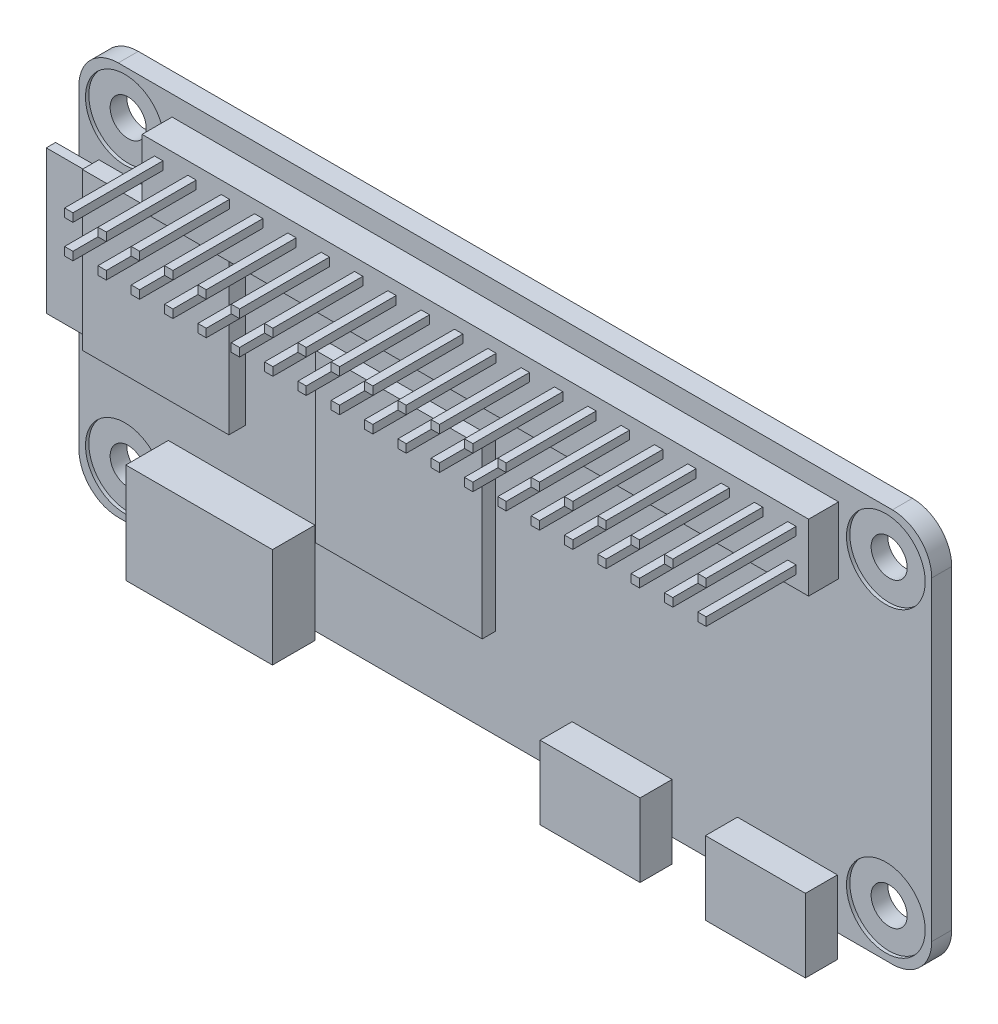
from build123d import *

# Parameters (mm, degrees)
SKETCH1_W            = 65
SKETCH1_H            = 30
BOSS_EXTRUDE1_DEPTH  = 1.524
FILLET1_R            = 3
SKETCH2_R            = 1.375
CUT_EXTRUDE1_DEPTH   = 72.605325053
SKETCH3_R            = 3
CUT_EXTRUDE2_DEPTH   = 0.254
SKETCH4_W            = 7.62
SKETCH4_H            = 5.588
BOSS_EXTRUDE2_DEPTH  = 2.4384
SKETCH5_W            = 11.176
SKETCH5_H            = 7.62
BOSS_EXTRUDE3_DEPTH  = 3.2385
SKETCH6_W            = 11.176
SKETCH6_H            = 11.938
BOSS_EXTRUDE4_DEPTH  = 1.27
SKETCH7_W            = 0.7112
SKETCH7_H            = 10.922
BOSS_EXTRUDE7_DEPTH  = 3.302
SKETCH8_W            = 50.8
SKETCH8_H            = 5.08
BOSS_EXTRUDE8_DEPTH  = 2.286
SKETCH9_W            = 0.635
SKETCH9_H            = 0.635
BOSS_EXTRUDE9_DEPTH  = 6.858
LPATTERN1_COUNT      = 20
LPATTERN1_PITCH      = 2.54
SKETCH10_W           = 12.7
SKETCH10_H           = 12.7
BOSS_EXTRUDE10_DEPTH = 1.016


with BuildPart() as part:
    # Sketch1 → Boss-Extrude1 (new body)
    with BuildSketch(Plane.XY):
        with Locations((32.5, 15)):
            Rectangle(SKETCH1_W, SKETCH1_H)
    extrude(amount=BOSS_EXTRUDE1_DEPTH)

    # Fillet1
    fillet1_edges = [part.edges().sort_by_distance(p)[0] for p in [
        (0, 30, 0.762),
        (65, 30, 0.762),
        (65, 0, 0.762),
        (0, 0, 0.762),
    ]]
    fillet(fillet1_edges, radius=FILLET1_R)

    # Sketch2 → Cut-Extrude1 (cut, through all)
    with BuildSketch(Plane.XY.offset(1.524)):
        with Locations((3.5, 26.5)):
            Circle(SKETCH2_R)
        with Locations((61.5, 26.5)):
            Circle(SKETCH2_R)
        with Locations((61.5, 3.5)):
            Circle(SKETCH2_R)
        with Locations((3.5, 3.5)):
            Circle(SKETCH2_R)
    extrude(amount=-CUT_EXTRUDE1_DEPTH, mode=Mode.SUBTRACT)

    # Sketch3 → Cut-Extrude2 (cut)
    with BuildSketch(Plane.XY.offset(1.524)):
        with Locations((3.5, 26.5)):
            Circle(SKETCH3_R)
        with Locations((61.5, 26.5)):
            Circle(SKETCH3_R)
        with Locations((61.5, 3.5)):
            Circle(SKETCH3_R)
        with Locations((3.5, 3.5)):
            Circle(SKETCH3_R)
    extrude(amount=-CUT_EXTRUDE2_DEPTH, mode=Mode.SUBTRACT)

    # Sketch4 → Boss-Extrude2 (add)
    with BuildSketch(Plane.XY.offset(1.524)):
        with Locations((41.4, 1.016)):
            Rectangle(SKETCH4_W, SKETCH4_H)
        with Locations((54, 1.016)):
            Rectangle(SKETCH4_W, SKETCH4_H)
    extrude(amount=BOSS_EXTRUDE2_DEPTH)

    # Sketch5 → Boss-Extrude3 (add)
    with BuildSketch(Plane.XY.offset(1.524)):
        with Locations((12.4, 3.175)):
            Rectangle(SKETCH5_W, SKETCH5_H)
    extrude(amount=BOSS_EXTRUDE3_DEPTH)

    # Sketch6 → Boss-Extrude4 (add)
    with BuildSketch(Plane.XY.offset(1.524)):
        with Locations((7.112, 16.9)):
            Rectangle(SKETCH6_W, SKETCH6_H)
    extrude(amount=BOSS_EXTRUDE4_DEPTH)

    # Sketch7 → Boss-Extrude7 (add)
    with BuildSketch(Plane.ZY.offset(-1.524)):
        with Locations((1.8796, 16.9)):
            Rectangle(SKETCH7_W, SKETCH7_H)
    extrude(amount=BOSS_EXTRUDE7_DEPTH)

    # Sketch8 → Boss-Extrude8 (add)
    with BuildSketch(Plane.XY.offset(1.524)):
        with Locations((32.5, 25.936)):
            Rectangle(SKETCH8_W, SKETCH8_H)
    extrude(amount=BOSS_EXTRUDE8_DEPTH)

    # Sketch9 → Boss-Extrude9 (add)
    with BuildSketch(Plane.XY.offset(3.81)):
        with Locations((8.37, 27.206)):
            Rectangle(SKETCH9_W, SKETCH9_H)
        with Locations((8.37, 24.666)):
            Rectangle(SKETCH9_W, SKETCH9_H)
    boss_extrude9 = extrude(amount=BOSS_EXTRUDE9_DEPTH)

    # LPattern1: Boss-Extrude9 ×20
    with Locations(*[(i * LPATTERN1_PITCH, 0, 0) for i in range(1, LPATTERN1_COUNT)]):
        add(boss_extrude9)

    # Sketch10 → Boss-Extrude10 (add)
    with BuildSketch(Plane.XY.offset(1.524)):
        with Locations((25.4, 13.208)):
            Rectangle(SKETCH10_W, SKETCH10_H)
    extrude(amount=BOSS_EXTRUDE10_DEPTH)


solid = part.part
